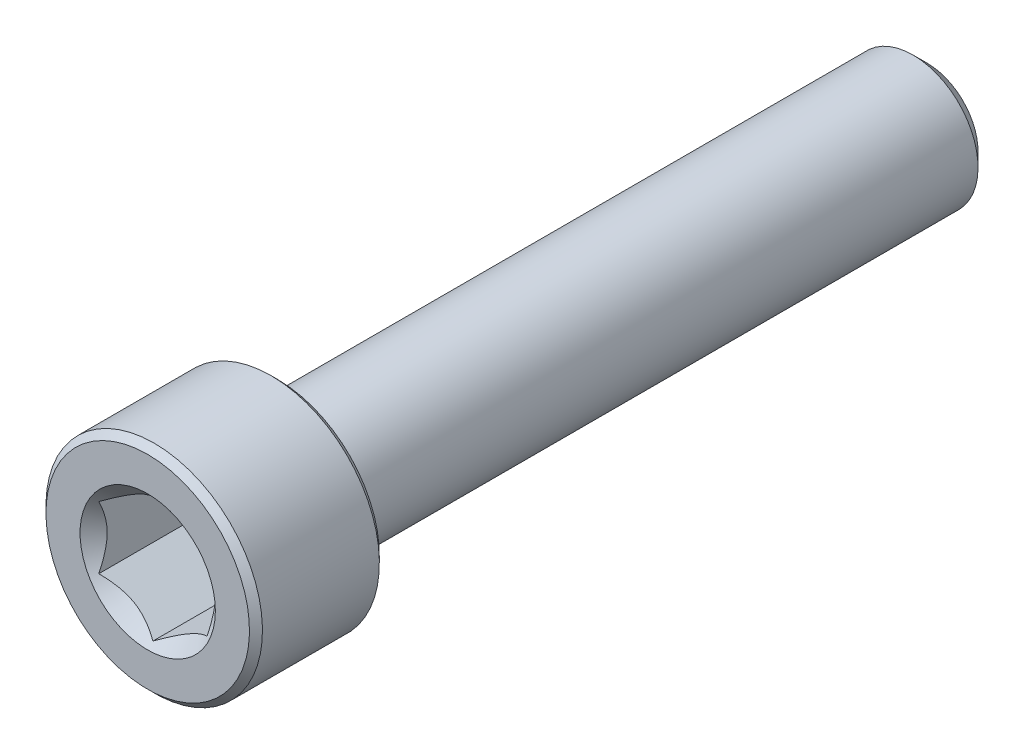
from build123d import *

# Parameters (mm, degrees)
CUT_EXTRUDE1_DEPTH = 5
SKETCH4_R          = 3.125
CUT_EXTRUDE2_DEPTH = 3
CUT_EXTRUDE2_DRAFT = -45


with BuildPart() as part:
    # Sketch2 → Revolve1 (revolve)
    with BuildSketch(Plane(origin=(0, 0, 0), x_dir=(0, 0, -1), z_dir=(1, 0, 0))):
        with BuildLine():
            Line((-18, 0), (-18, 4.7))
            Line((-18, 4.7), (-17.7, 5))
            Line((-17.7, 5), (-12.3, 5))
            Line((-12.3, 5), (-12, 4.7))
            Line((-12, 4.7), (-12, 3.3))
            ThreePointArc((-12, 3.3), (-11.912132034, 3.087867966), (-11.7, 3))
            Line((-11.7, 3), (17.350480947, 3))
            Line((17.350480947, 3), (18, 2.350480947))
            Line((18, 2.350480947), (18, 0))
            Line((18, 0), (-18, 0))
        make_face()
    revolve(axis=Axis((0, 0, -18), (0, 0, 1)))

    # Sketch3 → Cut-Extrude1 (cut)
    with BuildSketch(Plane.XY.offset(18)):
        Polygon((2.5, -1.443375673), (2.5, 1.443375673), (0, 2.886751346), (-2.5, 1.443375673), (-2.5, -1.443375673), (0, -2.886751346), align=None)
    extrude(amount=-CUT_EXTRUDE1_DEPTH, mode=Mode.SUBTRACT)


with BuildPart() as cut_extrude2_tool:
    # Sketch4 → Cut-Extrude2 (with draft: the straight prism first)
    with BuildSketch(Plane.XY.offset(18)):
        Circle(SKETCH4_R)
    extrude(amount=-CUT_EXTRUDE2_DEPTH)
    # Cut-Extrude2: the draft: its side faces are tilted about the plane it starts from
    cut_extrude2_sides = [cut_extrude2_tool.faces().sort_by_distance(p)[0] for p in [
        (-3.125, 0, 16.5),
    ]]
    draft(cut_extrude2_sides, Plane.XY.offset(18), CUT_EXTRUDE2_DRAFT)


with BuildPart() as part_1:
    add(part.part)

    # Cut-Extrude2: cut by cut_extrude2_tool
    add(cut_extrude2_tool.part, mode=Mode.SUBTRACT)


solid = part_1.part
